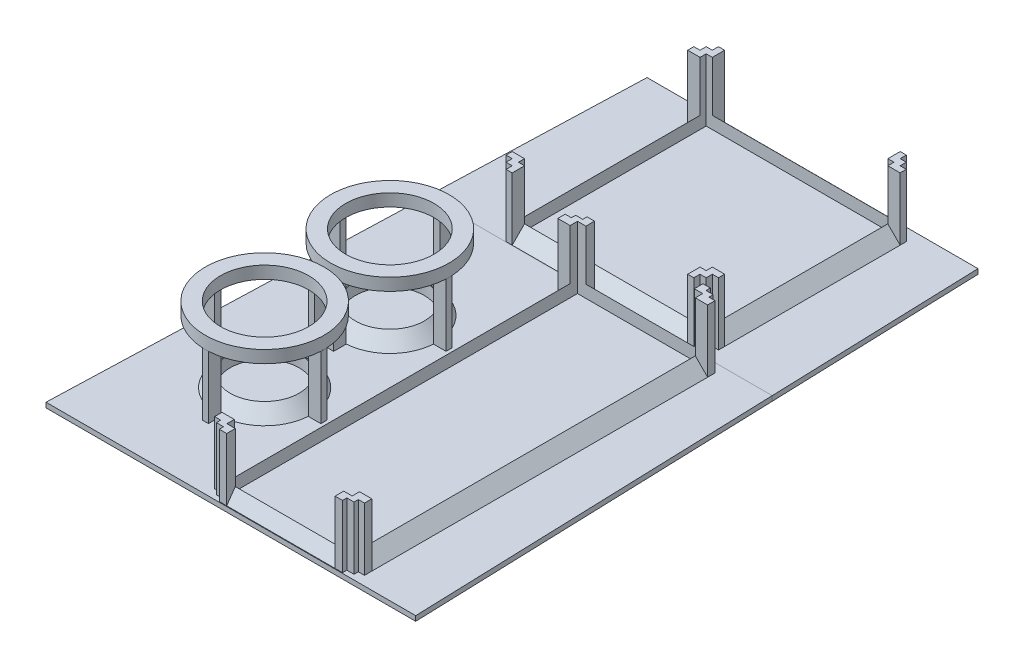
from build123d import *

# Parameters (mm, degrees)
BOSS_EXTRUDE1_DEPTH  = 2
BOSS_EXTRUDE2_DEPTH  = 76.2
BOSS_EXTRUDE7_DEPTH  = 38
BOSS_EXTRUDE9_DEPTH  = 71.12
SKETCH19_W           = 5
SKETCH19_H           = 2.5
SKETCH19_W_2         = 2.5
SKETCH19_H_2         = 5
BOSS_EXTRUDE13_DEPTH = 25.4
SKETCH20_R           = 24.05
SKETCH20_R_2         = 17.907
BOSS_EXTRUDE14_DEPTH = 5
SKETCH21_W           = 2.5
SKETCH21_H           = 5
SKETCH21_H_2         = 2.5
SKETCH21_W_2         = 5
BOSS_EXTRUDE15_DEPTH = 25.4
BOSS_EXTRUDE16_DEPTH = 25
BOSS_EXTRUDE17_REACH = 145.084
SKETCH24_W           = 5
SKETCH24_H           = 3
SKETCH24_W_2         = 3
SKETCH24_H_2         = 3.5


with BuildPart() as part:
    # Sketch1 → Boss-Extrude1 (new body)
    with BuildSketch(Plane(origin=(0, 0, 0), x_dir=(1, 0, 0), z_dir=(0, 1, 0))):
        Polygon((0, 118), (0, -118), (75, -118), (67.135, 118), align=None)
        Polygon((-75, -118), (0, -118), (0, 118), (-67.135, 118), align=None)
    extrude(amount=BOSS_EXTRUDE1_DEPTH)

    # Sketch7 → Boss-Extrude2 (add)
    with BuildSketch(Plane.XY.offset(-36.75)):
        Polygon((-38.1, 2), (-38.1, 7), (-43.1, 2), align=None)
    boss_extrude2 = extrude(amount=-BOSS_EXTRUDE2_DEPTH)

    # Mirror1: Boss-Extrude2 across plane
    add(boss_extrude2.mirror(Plane(origin=(0, 0, 0), x_dir=(0, 0, 1), z_dir=(1, 0, 0))))

    # Sketch9 → Boss-Extrude7 (add, symmetric)
    with BuildSketch(Plane(origin=(0, 0, 0), x_dir=(0, 0, -1), z_dir=(1, 0, 0))):
        Polygon((112.95, 2), (117.95, 2), (112.95, 7), align=None)
    boss_extrude7 = extrude(amount=BOSS_EXTRUDE7_DEPTH, both=True)

    # Mirror2: Boss-Extrude7 across plane
    add(boss_extrude7.mirror(Plane.XY.offset(-74.85)))

    # Sketch12 → Boss-Extrude9 (add, symmetric)
    with BuildSketch(Plane.XY.offset(43.13)):
        Polygon((-10.345454545, 2), (-5.345454545, 2), (-5.345454545, 7), align=None)
    boss_extrude9 = extrude(amount=BOSS_EXTRUDE9_DEPTH, both=True)

    # Mirror4: Boss-Extrude9 across plane
    add(boss_extrude9.mirror(Plane(origin=(20.054545455, 0, 0), x_dir=(0, 0, 1), z_dir=(1, 0, 0))))

    # Sketch17 → Revolve1 (revolve)
    with BuildSketch(Plane.XY.offset(17.73), mode=Mode.PRIVATE) as revolve1_sk:
        Polygon((-49.727575758, 2), (-49.727575758, 7), (-54.727575758, 2), align=None)
    revolve1 = revolve(revolve1_sk.sketch.rotate(Axis((-35.757575758, 2, 17.73), (0, 1, 0)), 270), axis=Axis((-35.757575758, 2, 17.73), (0, 1, 0)))

    # Mirror7: Revolve1 across plane
    add(revolve1.mirror(Plane.XY.offset(43.13)))

    # Sketch19 → Boss-Extrude13 (add)
    with BuildSketch(Plane(origin=(0, 2, 0), x_dir=(1, 0, 0), z_dir=(0, 1, 0))):
        with Locations((-57.307575758, -17.73)):
            Rectangle(SKETCH19_W, SKETCH19_H)
        with Locations((-35.757575758, -39.28)):
            Rectangle(SKETCH19_W_2, SKETCH19_H_2)
        with Locations((-35.757575758, 3.82)):
            Rectangle(SKETCH19_W_2, SKETCH19_H_2)
        with Locations((-14.207575758, -17.73)):
            Rectangle(SKETCH19_W, SKETCH19_H)
    boss_extrude13 = extrude(amount=BOSS_EXTRUDE13_DEPTH)

    # Sketch20 → Boss-Extrude14 (add)
    with BuildSketch(Plane(origin=(0, 27.4, 0), x_dir=(1, 0, 0), z_dir=(0, 1, 0))):
        with Locations(Location((-35.757575758, -17.73, 0), (0, 0, 270))):
            Circle(SKETCH20_R)
        with Locations(Location((-35.757575758, -17.73, 0), (0, 0, 270))):
            Circle(SKETCH20_R_2, mode=Mode.SUBTRACT)
    boss_extrude14 = extrude(amount=BOSS_EXTRUDE14_DEPTH)

    # Mirror8: Boss-Extrude13, Boss-Extrude14 across plane
    add(boss_extrude13.mirror(Plane.XY.offset(43.13)))
    add(boss_extrude14.mirror(Plane.XY.offset(43.13)))

    # Sketch21 → Boss-Extrude15 (add)
    with BuildSketch(Plane(origin=(0, 2, 0), x_dir=(1, 0, 0), z_dir=(0, 1, 0))):
        with Locations((-36.85, 115.45)):
            Rectangle(SKETCH21_W, SKETCH21_H)
        with Locations((-39.35, 114.2)):
            Rectangle(SKETCH21_W, SKETCH21_H_2)
        with Locations((-40.6, 111.7)):
            Rectangle(SKETCH21_W_2, SKETCH21_H_2)
        with Locations((-40.6, 38)):
            Rectangle(SKETCH21_W_2, SKETCH21_H_2)
        with Locations((-39.35, 35.5)):
            Rectangle(SKETCH21_W, SKETCH21_H_2)
        with Locations((-36.85, 34.25)):
            Rectangle(SKETCH21_W, SKETCH21_H)
        with Locations((40.6, 38)):
            Rectangle(SKETCH21_W_2, SKETCH21_H_2)
        with Locations((39.35, 35.5)):
            Rectangle(SKETCH21_W, SKETCH21_H_2)
        with Locations((36.85, 34.25)):
            Rectangle(SKETCH21_W, SKETCH21_H)
        with Locations((36.85, 115.45)):
            Rectangle(SKETCH21_W, SKETCH21_H)
        with Locations((40.6, 111.7)):
            Rectangle(SKETCH21_W_2, SKETCH21_H_2)
        with Locations((39.35, 114.2)):
            Rectangle(SKETCH21_W, SKETCH21_H_2)
    extrude(amount=BOSS_EXTRUDE15_DEPTH)

    # Sketch23 → Boss-Extrude16 (add, symmetric)
    with BuildSketch(Plane(origin=(20.054545455, 0, 0), x_dir=(0, 0, -1), z_dir=(1, 0, 0))):
        Polygon((27.99, 2), (27.99, 7), (31.49, 2), align=None)
    boss_extrude16 = extrude(amount=BOSS_EXTRUDE16_DEPTH, both=True)

    # Mirror10: Boss-Extrude16 across plane
    add(boss_extrude16.mirror(Plane.XY.offset(43.13)))

    # Boss-Extrude17: up to this face of the body (flat: up to its plane)
    boss_extrude17_end = Plane(part.part.faces().sort_by_distance((-38.85, 27.4, -36))[0])
    # Sketch24 → Boss-Extrude17 (add, up to the picked face)
    with BuildSketch(Plane(origin=(0, 2, 0), x_dir=(1, 0, 0), z_dir=(0, 1, 0)), mode=Mode.PRIVATE) as boss_extrude17_sk1:
        with Locations((-7.845454545, 26.49)):
            Rectangle(SKETCH24_W, SKETCH24_H)
    boss_extrude17_tool1 = split(extrude(boss_extrude17_sk1.sketch, amount=BOSS_EXTRUDE17_REACH, mode=Mode.PRIVATE), bisect_by=boss_extrude17_end, keep=Keep.BOTH, mode=Mode.PRIVATE)
    # Sketch24 → Boss-Extrude17 (add, up to the picked face)
    with BuildSketch(Plane(origin=(0, 2, 0), x_dir=(1, 0, 0), z_dir=(0, 1, 0)), mode=Mode.PRIVATE) as boss_extrude17_sk2:
        Polygon((-4.945454545, 27.99), (-4.945454545, 29.74), (-7.845454545, 29.74), (-7.845454545, 27.99), (-5.345454545, 27.99), align=None)
    boss_extrude17_tool2 = split(extrude(boss_extrude17_sk2.sketch, amount=BOSS_EXTRUDE17_REACH, mode=Mode.PRIVATE), bisect_by=boss_extrude17_end, keep=Keep.BOTH, mode=Mode.PRIVATE)
    # Sketch24 → Boss-Extrude17 (add, up to the picked face)
    with BuildSketch(Plane(origin=(0, 2, 0), x_dir=(1, 0, 0), z_dir=(0, 1, 0)), mode=Mode.PRIVATE) as boss_extrude17_sk3:
        with Locations((-3.445454545, 29.74)):
            Rectangle(SKETCH24_W_2, SKETCH24_H_2)
    boss_extrude17_tool3 = split(extrude(boss_extrude17_sk3.sketch, amount=BOSS_EXTRUDE17_REACH, mode=Mode.PRIVATE), bisect_by=boss_extrude17_end, keep=Keep.BOTH, mode=Mode.PRIVATE)
    # Sketch24 → Boss-Extrude17 (add, up to the picked face)
    with BuildSketch(Plane(origin=(0, 2, 0), x_dir=(1, 0, 0), z_dir=(0, 1, 0)), mode=Mode.PRIVATE) as boss_extrude17_sk4:
        with Locations((43.554545455, 29.74)):
            Rectangle(SKETCH24_W_2, SKETCH24_H_2)
    boss_extrude17_tool4 = split(extrude(boss_extrude17_sk4.sketch, amount=BOSS_EXTRUDE17_REACH, mode=Mode.PRIVATE), bisect_by=boss_extrude17_end, keep=Keep.BOTH, mode=Mode.PRIVATE)
    # Sketch24 → Boss-Extrude17 (add, up to the picked face)
    with BuildSketch(Plane(origin=(0, 2, 0), x_dir=(1, 0, 0), z_dir=(0, 1, 0)), mode=Mode.PRIVATE) as boss_extrude17_sk5:
        Polygon((45.054545455, 29.74), (45.054545455, 27.99), (45.454545455, 27.99), (47.954545455, 27.99), (47.954545455, 29.74), align=None)
    boss_extrude17_tool5 = split(extrude(boss_extrude17_sk5.sketch, amount=BOSS_EXTRUDE17_REACH, mode=Mode.PRIVATE), bisect_by=boss_extrude17_end, keep=Keep.BOTH, mode=Mode.PRIVATE)
    # Sketch24 → Boss-Extrude17 (add, up to the picked face)
    with BuildSketch(Plane(origin=(0, 2, 0), x_dir=(1, 0, 0), z_dir=(0, 1, 0)), mode=Mode.PRIVATE) as boss_extrude17_sk6:
        with Locations((47.954545455, 26.49)):
            Rectangle(SKETCH24_W, SKETCH24_H)
    boss_extrude17_tool6 = split(extrude(boss_extrude17_sk6.sketch, amount=BOSS_EXTRUDE17_REACH, mode=Mode.PRIVATE), bisect_by=boss_extrude17_end, keep=Keep.BOTH, mode=Mode.PRIVATE)
    # Sketch24 → Boss-Extrude17 (add, up to the picked face)
    with BuildSketch(Plane(origin=(0, 2, 0), x_dir=(1, 0, 0), z_dir=(0, 1, 0)), mode=Mode.PRIVATE) as boss_extrude17_sk7:
        with Locations((47.954545455, -112.75)):
            Rectangle(SKETCH24_W, SKETCH24_H)
    boss_extrude17_tool7 = split(extrude(boss_extrude17_sk7.sketch, amount=BOSS_EXTRUDE17_REACH, mode=Mode.PRIVATE), bisect_by=boss_extrude17_end, keep=Keep.BOTH, mode=Mode.PRIVATE)
    # Sketch24 → Boss-Extrude17 (add, up to the picked face)
    with BuildSketch(Plane(origin=(0, 2, 0), x_dir=(1, 0, 0), z_dir=(0, 1, 0)), mode=Mode.PRIVATE) as boss_extrude17_sk8:
        Polygon((45.454545455, -114.25), (45.054545455, -114.25), (45.054545455, -116), (47.954545455, -116), (47.954545455, -114.25), align=None)
    boss_extrude17_tool8 = split(extrude(boss_extrude17_sk8.sketch, amount=BOSS_EXTRUDE17_REACH, mode=Mode.PRIVATE), bisect_by=boss_extrude17_end, keep=Keep.BOTH, mode=Mode.PRIVATE)
    # Sketch24 → Boss-Extrude17 (add, up to the picked face)
    with BuildSketch(Plane(origin=(0, 2, 0), x_dir=(1, 0, 0), z_dir=(0, 1, 0)), mode=Mode.PRIVATE) as boss_extrude17_sk9:
        with Locations((43.554545455, -116)):
            Rectangle(SKETCH24_W_2, SKETCH24_H_2)
    boss_extrude17_tool9 = split(extrude(boss_extrude17_sk9.sketch, amount=BOSS_EXTRUDE17_REACH, mode=Mode.PRIVATE), bisect_by=boss_extrude17_end, keep=Keep.BOTH, mode=Mode.PRIVATE)
    # Sketch24 → Boss-Extrude17 (add, up to the picked face)
    with BuildSketch(Plane(origin=(0, 2, 0), x_dir=(1, 0, 0), z_dir=(0, 1, 0)), mode=Mode.PRIVATE) as boss_extrude17_sk10:
        with Locations((-3.445454545, -116)):
            Rectangle(SKETCH24_W_2, SKETCH24_H_2)
    boss_extrude17_tool10 = split(extrude(boss_extrude17_sk10.sketch, amount=BOSS_EXTRUDE17_REACH, mode=Mode.PRIVATE), bisect_by=boss_extrude17_end, keep=Keep.BOTH, mode=Mode.PRIVATE)
    # Sketch24 → Boss-Extrude17 (add, up to the picked face)
    with BuildSketch(Plane(origin=(0, 2, 0), x_dir=(1, 0, 0), z_dir=(0, 1, 0)), mode=Mode.PRIVATE) as boss_extrude17_sk11:
        Polygon((-4.945454545, -116), (-4.945454545, -114.25), (-5.345454545, -114.25), (-7.845454545, -114.25), (-7.845454545, -116), align=None)
    boss_extrude17_tool11 = split(extrude(boss_extrude17_sk11.sketch, amount=BOSS_EXTRUDE17_REACH, mode=Mode.PRIVATE), bisect_by=boss_extrude17_end, keep=Keep.BOTH, mode=Mode.PRIVATE)
    # Sketch24 → Boss-Extrude17 (add, up to the picked face)
    with BuildSketch(Plane(origin=(0, 2, 0), x_dir=(1, 0, 0), z_dir=(0, 1, 0)), mode=Mode.PRIVATE) as boss_extrude17_sk12:
        with Locations((-7.845454545, -112.75)):
            Rectangle(SKETCH24_W, SKETCH24_H)
    boss_extrude17_tool12 = split(extrude(boss_extrude17_sk12.sketch, amount=BOSS_EXTRUDE17_REACH, mode=Mode.PRIVATE), bisect_by=boss_extrude17_end, keep=Keep.BOTH, mode=Mode.PRIVATE)
    add(boss_extrude17_tool1.solids().sort_by(Axis((-7.845455, 2, -26.49), (0, 1, 0)))[0])
    add(boss_extrude17_tool2.solids().sort_by(Axis((-6.395455, 2, -28.865), (0, 1, 0)))[0])
    add(boss_extrude17_tool3.solids().sort_by(Axis((-3.445455, 2, -29.74), (0, 1, 0)))[0])
    add(boss_extrude17_tool4.solids().sort_by(Axis((43.554545, 2, -29.74), (0, 1, 0)))[0])
    add(boss_extrude17_tool5.solids().sort_by(Axis((46.504545, 2, -28.865), (0, 1, 0)))[0])
    add(boss_extrude17_tool6.solids().sort_by(Axis((47.954545, 2, -26.49), (0, 1, 0)))[0])
    add(boss_extrude17_tool7.solids().sort_by(Axis((47.954545, 2, 112.75), (0, 1, 0)))[0])
    add(boss_extrude17_tool8.solids().sort_by(Axis((46.504545, 2, 115.125), (0, 1, 0)))[0])
    add(boss_extrude17_tool9.solids().sort_by(Axis((43.554545, 2, 116), (0, 1, 0)))[0])
    add(boss_extrude17_tool10.solids().sort_by(Axis((-3.445455, 2, 116), (0, 1, 0)))[0])
    add(boss_extrude17_tool11.solids().sort_by(Axis((-6.395455, 2, 115.125), (0, 1, 0)))[0])
    add(boss_extrude17_tool12.solids().sort_by(Axis((-7.845455, 2, 112.75), (0, 1, 0)))[0])


with BuildPart() as body_2:
    # Split1: the piece on the far side of the plane
    add(part.part)
    split(bisect_by=Plane(origin=(0, 0, -31.62), x_dir=(-1, 0, 0), z_dir=(0, 0, -1)), keep=Keep.BOTTOM)


with BuildPart() as part_1:
    add(part.part)

    # Split1
    split(bisect_by=Plane(origin=(0, 0, -31.62), x_dir=(-1, 0, 0), z_dir=(0, 0, -1)), keep=Keep.TOP)


solid = Compound([body_2.part, part_1.part])
